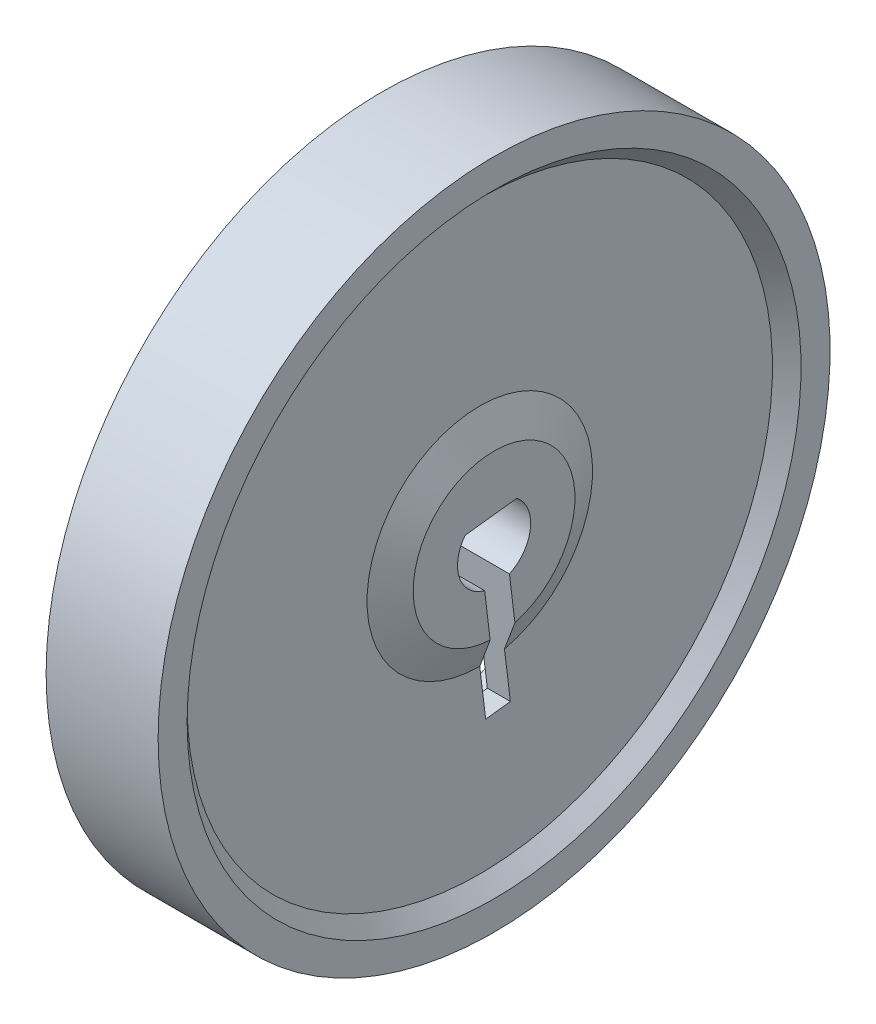
from build123d import *

# Parameters (mm, degrees)
CORTAR_EXTRUIR1_DEPTH = 10


with BuildPart() as part:
    # Croquis1 → Revolución2 (revolve)
    with BuildSketch(Plane.XY, mode=Mode.PRIVATE) as revoluci_n2_sk:
        Polygon((0, 12.334092632), (0, 13.5), (-4.5, 13.5), (-4.5, 9.583549686), (-1.5, 9.583549686), (-1.5, 3.25), (-7, 3.25), (-7, 0), (0, 0), (0, 3.25), (-0.574918787, 4.530302725), (-0.574918787, 11.759173845), align=None)
    revolve(revoluci_n2_sk.sketch.rotate(Axis((-7, 0, 0), (1, 0, 0)), 90), axis=Axis((-7, 0, 0), (1, 0, 0)))

    # Croquis2 → Cortar-Extruir1 (cut)
    with BuildSketch(Plane(origin=(0, 0, 0), x_dir=(0, 0, -1), z_dir=(1, 0, 0))):
        with BuildLine():
            Line((0.916823697, 1.149058009), (0.524737182, 1.101385895))
            Line((0.524737182, 1.101385895), (-0.77337267, 0.943554298))
            Line((-0.77337267, 0.943554298), (-1.165459185, 0.895882184))
            ThreePointArc((-1.165459185, 0.895882184), (-1.392146699, -0.472046151), (-0.380201076, -1.419981388))
            Line((-0.380201076, -1.419981388), (0.236111814, -6.488940003))
            Line((0.236111814, -6.488940003), (1.228801228, -6.368243164))
            Line((1.228801228, -6.368243164), (0.616752973, -1.334359685))
            ThreePointArc((0.616752973, -1.334359685), (1.459385217, -0.176337142), (0.916823697, 1.149058009))
        make_face()
    extrude(amount=-CORTAR_EXTRUIR1_DEPTH, mode=Mode.SUBTRACT)


solid = part.part
